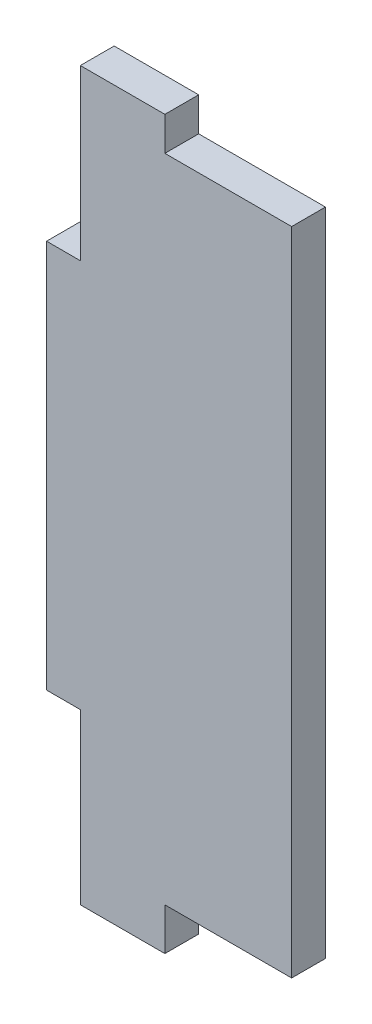
from build123d import *

# Parameters (mm, degrees)
BOSS_EXTRUDE1_DEPTH = 4


with BuildPart() as part:
    # Sketch1 → Boss-Extrude1 (new body)
    with BuildSketch(Plane.XY):
        Polygon((0, 66), (0, 86), (10, 86), (10, 82), (25, 82), (25, 5), (10, 5), (10, 0), (0, 0), (0, 20), (-4, 20), (-4, 66), align=None)
    extrude(amount=BOSS_EXTRUDE1_DEPTH)


solid = part.part
